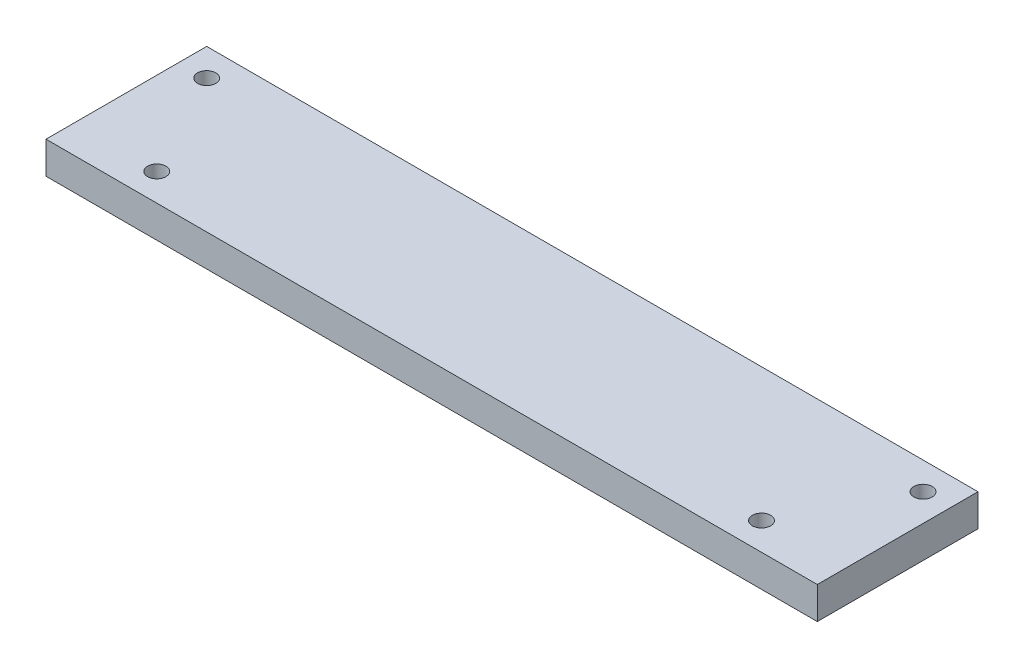
from build123d import *

# Parameters (mm, degrees)
SKETCH2_W           = 304.8
SKETCH2_H           = 63.5
SKETCH2_R           = 3.6195
BOSS_EXTRUDE1_DEPTH = 12.7


with BuildPart() as part:
    # Sketch2 → Boss-Extrude1 (new body)
    with BuildSketch(Plane(origin=(0, 0, 0), x_dir=(1, 0, 0), z_dir=(0, 1, 0))):
        with Locations((152.4, 31.75)):
            Rectangle(SKETCH2_W, SKETCH2_H)
        with Locations(Location((293.9415, 52.6415, 0), (0, 0, 270))):
            Circle(SKETCH2_R, mode=Mode.SUBTRACT)
        with Locations(Location((271.892090779, 10.8585, 0), (0, 0, 270))):
            Circle(SKETCH2_R, mode=Mode.SUBTRACT)
        with Locations(Location((32.907909221, 10.8585, 0), (0, 0, 90))):
            Circle(SKETCH2_R, mode=Mode.SUBTRACT)
        with Locations(Location((10.8585, 52.6415, 0), (0, 0, 90))):
            Circle(SKETCH2_R, mode=Mode.SUBTRACT)
    extrude(amount=BOSS_EXTRUDE1_DEPTH)


solid = part.part
